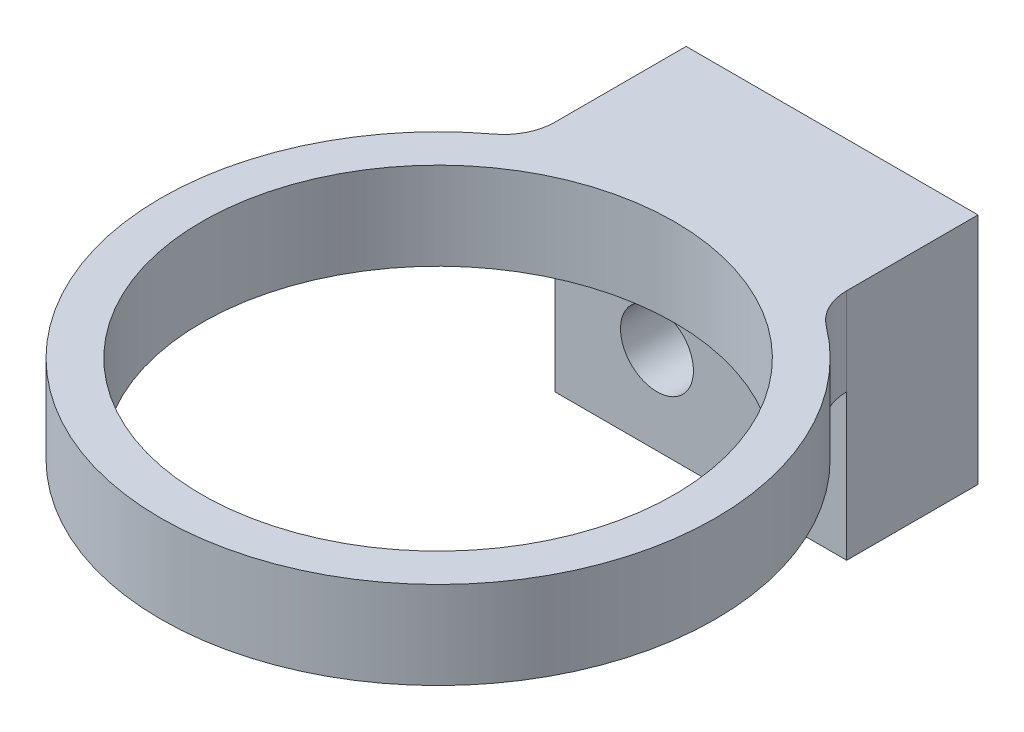
from build123d import *

# Parameters (mm, degrees)
BOSS_EXTRUDE1_DEPTH            = 3
SKETCH2_W                      = 10
SKETCH2_H                      = 4.5
BOSS_EXTRUDE2_DEPTH            = 5
F_1_6_1_6_DIAMETER_HOLE1_D     = 1.6
F_1_6_1_6_DIAMETER_HOLE1_DEPTH = 4
F_1_6_1_6_DIAMETER_HOLE1_TIP   = 0.480688495
F_2_5_2_5_DIAMETER_HOLE1_D     = 2.5
M14_CLEARANCE_HOLE1_D          = 16.2
FILLET1_R                      = 1.749999932


with BuildPart() as part:
    # Sketch1 → Boss-Extrude1 (new body)
    with BuildSketch(Plane.XZ):
        with BuildLine():
            Line((-5, 5.422252789), (-5, 0))
            Line((-5, 0), (5, 0))
            Line((5, 0), (5, 5.422252789))
            ThreePointArc((5, 5.422252789), (0, 23), (-5, 5.422252789))
        make_face()
    extrude(amount=-BOSS_EXTRUDE1_DEPTH)

    # Sketch2 → Boss-Extrude2 (add)
    with BuildSketch(Plane.XZ):
        with Locations((0, 2.25)):
            Rectangle(SKETCH2_W, SKETCH2_H)
    extrude(amount=BOSS_EXTRUDE2_DEPTH)

    # Ø1.6 (1.6) Diameter Hole1
    with Locations(Plane(origin=(0, 0, 0), x_dir=(-1, 0, 0), z_dir=(0, 0, -1))):
        with Locations((-3, 1)):
            Hole(F_1_6_1_6_DIAMETER_HOLE1_D / 2, depth=F_1_6_1_6_DIAMETER_HOLE1_DEPTH)
            with Locations((0, 0, -(F_1_6_1_6_DIAMETER_HOLE1_DEPTH + F_1_6_1_6_DIAMETER_HOLE1_TIP / 2))):  # 118° drill point
                Cone(0, F_1_6_1_6_DIAMETER_HOLE1_D / 2, F_1_6_1_6_DIAMETER_HOLE1_TIP, mode=Mode.SUBTRACT)

    # Ø2.5 (2.5) Diameter Hole1 (through all)
    with Locations(Plane.XY.offset(4.5)):
        with Locations((-1.5, -2)):
            Hole(F_2_5_2_5_DIAMETER_HOLE1_D / 2)

    # M14 Clearance Hole1 (through all)
    with Locations(Plane(origin=(0, 0, 0), x_dir=(-1, 0, 0), z_dir=(0, -1, 0))):
        with Locations((0, -13.5)):
            Hole(M14_CLEARANCE_HOLE1_D / 2)

    # Fillet1
    fillet1_edges = [part.edges().sort_by_distance(p)[0] for p in [
        (-5, 1.5, 5.422252789),
        (5, 1.5, 5.422252789),
    ]]
    fillet(fillet1_edges, radius=FILLET1_R)


solid = part.part
